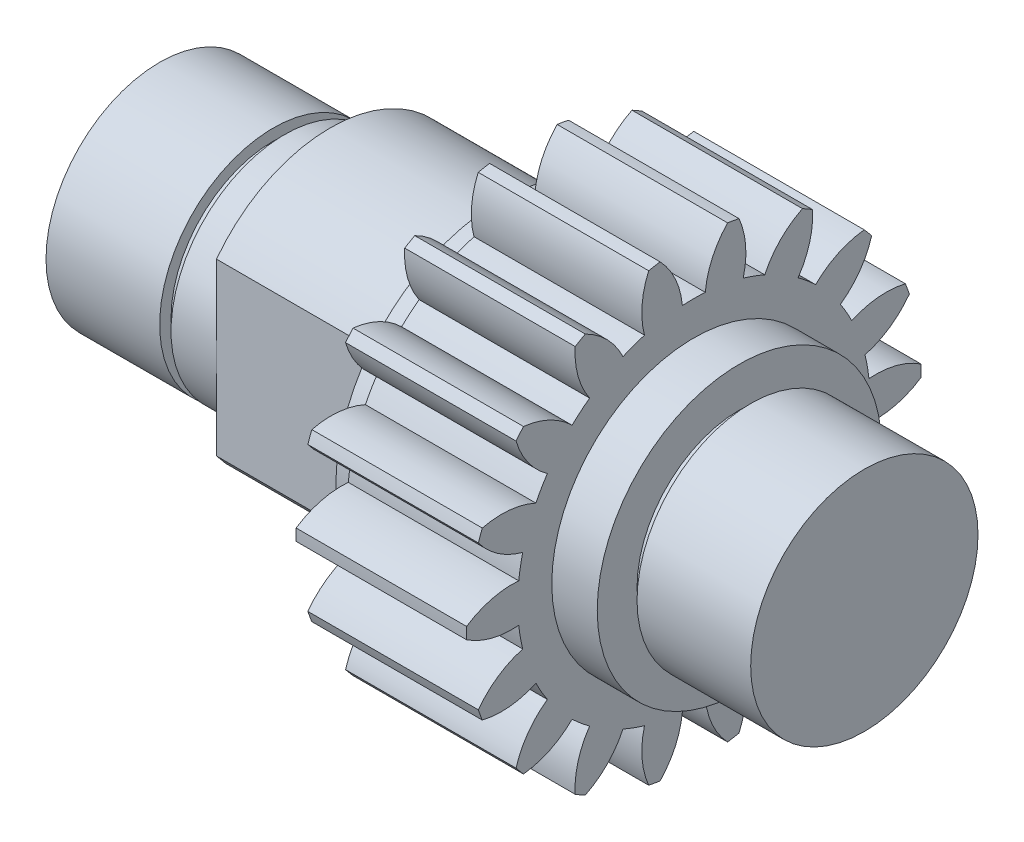
from build123d import *

# Parameters (mm, degrees)
BASPROSKE_W         = 15
BASPROSKE_H         = 20
TOOTHCUT_DEPTH      = 33.015621187
TEETHCUTS_COUNT     = 18
TEETHCUTS_ANGLE     = 340
BORSKE_R            = 0.4
BORE_DEPTH          = 50.0000508
SKETCH1_R           = 12.5
BOSS_EXTRUDE1_DEPTH = 4
SKETCH1_3_R         = 10
BOSS_EXTRUDE2_DEPTH = 15
SKETCH2_W           = 1
SKETCH2_H           = 1
SKETCH3_R           = 14.5
BOSS_EXTRUDE3_DEPTH = 2
BOSS_EXTRUDE4_START = 17
SKETCH3_3_R         = 12.5
BOSS_EXTRUDE4_DEPTH = 17
BOSS_EXTRUDE5_START = 32
SKETCH3_4_R         = 10
BOSS_EXTRUDE5_DEPTH = 32
SKETCH4_W           = 1
SKETCH4_H           = 1
SKETCH5_OUTSIDE_W   = 58.744
SKETCH5_OUTSIDE_H   = 58.3
CUT_EXTRUDE1_DEPTH  = 15


with BuildPart() as part:
    # BasProSke → Base-Revolve (revolve)
    with BuildSketch(Plane(origin=(0, 0, 0), x_dir=(1, 0, 0), z_dir=(0, 1, 0)), mode=Mode.PRIVATE) as base_revolve_sk:
        with Locations((7.5, 10)):
            Rectangle(BASPROSKE_W, BASPROSKE_H)
    revolve(base_revolve_sk.sketch.rotate(Axis((-10, 0, 0), (1, 0, 0)), 180), axis=Axis((-10, 0, 0), (1, 0, 0)))

    # TooCutSke → ToothCut (cut, through all)
    with BuildSketch(Plane(origin=(0, 0, 0), x_dir=(0, 0, -1), z_dir=(1, 0, 0))):
        with BuildLine():
            ThreePointArc((1.007799284, 15.466199973), (0, 15.499), (-1.007799284, 15.466199973))
            ThreePointArc((-1.007799284, 15.466199973), (-1.630454606, 17.802374148), (-2.991345877, 19.800719558))
            ThreePointArc((-2.991345877, 19.800719558), (0, 20.0254), (2.991345877, 19.800719558))
            ThreePointArc((2.991345877, 19.800719558), (1.630454606, 17.802374148), (1.007799284, 15.466199973))
        make_face()
    toothcut = extrude(amount=TOOTHCUT_DEPTH, mode=Mode.SUBTRACT)

    # TeethCuts: ToothCut ×18 about axis
    teethcuts_axis = Axis((-10, 0, 0), (1, 0, 0))
    for i in range(1, TEETHCUTS_COUNT):
        add(toothcut.rotate(teethcuts_axis, i * TEETHCUTS_ANGLE / (TEETHCUTS_COUNT - 1)), mode=Mode.SUBTRACT)

    # BorSke → Bore (cut, symmetric)
    with BuildSketch(Plane(origin=(0, 0, 0), x_dir=(0, 0, -1), z_dir=(1, 0, 0))):
        with Locations(Location((0, 0, 0), (0, 0, 180))):
            Circle(BORSKE_R)
    extrude(amount=BORE_DEPTH, both=True, mode=Mode.SUBTRACT)

    # Sketch1 → Boss-Extrude1 (add)
    with BuildSketch(Plane(origin=(15, 0, 0), x_dir=(0, 0, -1), z_dir=(1, 0, 0))):
        with Locations(Location((0, 0, 0), (0, 0, 180))):
            Circle(SKETCH1_R)
    extrude(amount=BOSS_EXTRUDE1_DEPTH)

    # Sketch1<3> → Boss-Extrude2 (add)
    with BuildSketch(Plane(origin=(15, 0, 0), x_dir=(0, 0, -1), z_dir=(1, 0, 0))):
        Circle(SKETCH1_3_R)
    extrude(amount=BOSS_EXTRUDE2_DEPTH)

    # Sketch2 → Cut-Revolve1 (revolve, cut)
    with BuildSketch(Plane.XY, mode=Mode.PRIVATE) as cut_revolve1_sk:
        with Locations((19.5, 9.5)):
            Rectangle(SKETCH2_W, SKETCH2_H)
    revolve(cut_revolve1_sk.sketch.rotate(Axis((0, 0, 0), (1, 0, 0)), 90), axis=Axis((0, 0, 0), (1, 0, 0)), mode=Mode.SUBTRACT)

    # Sketch3 → Boss-Extrude3 (add)
    with BuildSketch(Plane.ZY):
        with Locations(Location((0, 0, 0), (0, 0, 180))):
            Circle(SKETCH3_R)
    extrude(amount=BOSS_EXTRUDE3_DEPTH)

    # Sketch3<3> → Boss-Extrude4 (add)
    with BuildSketch(Plane.ZY.offset(BOSS_EXTRUDE4_START)):
        Circle(SKETCH3_3_R)
    extrude(amount=-BOSS_EXTRUDE4_DEPTH)

    # Sketch3<4> → Boss-Extrude5 (add)
    with BuildSketch(Plane.ZY.offset(BOSS_EXTRUDE5_START)):
        Circle(SKETCH3_4_R)
    extrude(amount=-BOSS_EXTRUDE5_DEPTH)

    # Sketch4 → Cut-Revolve2 (revolve, cut)
    with BuildSketch(Plane.XY, mode=Mode.PRIVATE) as cut_revolve2_sk:
        with Locations((-21.5, 9.5)):
            Rectangle(SKETCH4_W, SKETCH4_H)
    revolve(cut_revolve2_sk.sketch.rotate(Axis((0, 0, 0), (-1, 0, 0)), 90), axis=Axis((0, 0, 0), (-1, 0, 0)), mode=Mode.SUBTRACT)

    # Sketch5 outside → Cut-Extrude1 (cut)
    with BuildSketch(Plane.ZY.offset(17)):
        Rectangle(SKETCH5_OUTSIDE_W, SKETCH5_OUTSIDE_H)
        with BuildLine():
            Line((-10, 7.5), (-10, -7.5))
            ThreePointArc((-10, -7.5), (0, -12.5), (10, -7.5))
            Line((10, -7.5), (10, 7.5))
            ThreePointArc((10, 7.5), (0, 12.5), (-10, 7.5))
        make_face(mode=Mode.SUBTRACT)
    extrude(amount=-CUT_EXTRUDE1_DEPTH, mode=Mode.SUBTRACT)


solid = part.part
